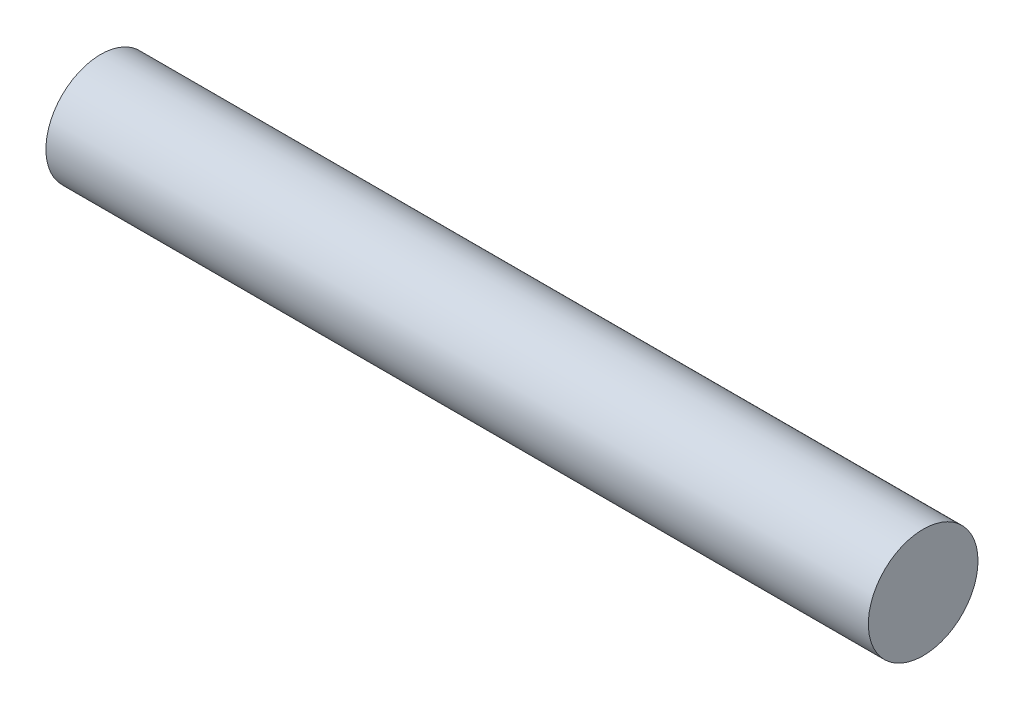
from build123d import *

# Parameters (mm, degrees)
ESBO_O1_R                = 2
RESSALTO_EXTRUS_O1_DEPTH = 30


with BuildPart() as part:
    # Esboço1 → Ressalto-extrusão1 (new body)
    with BuildSketch(Plane(origin=(0, 0, 0), x_dir=(0, 0, -1), z_dir=(1, 0, 0))):
        Circle(ESBO_O1_R)
    extrude(amount=RESSALTO_EXTRUS_O1_DEPTH)


solid = part.part
